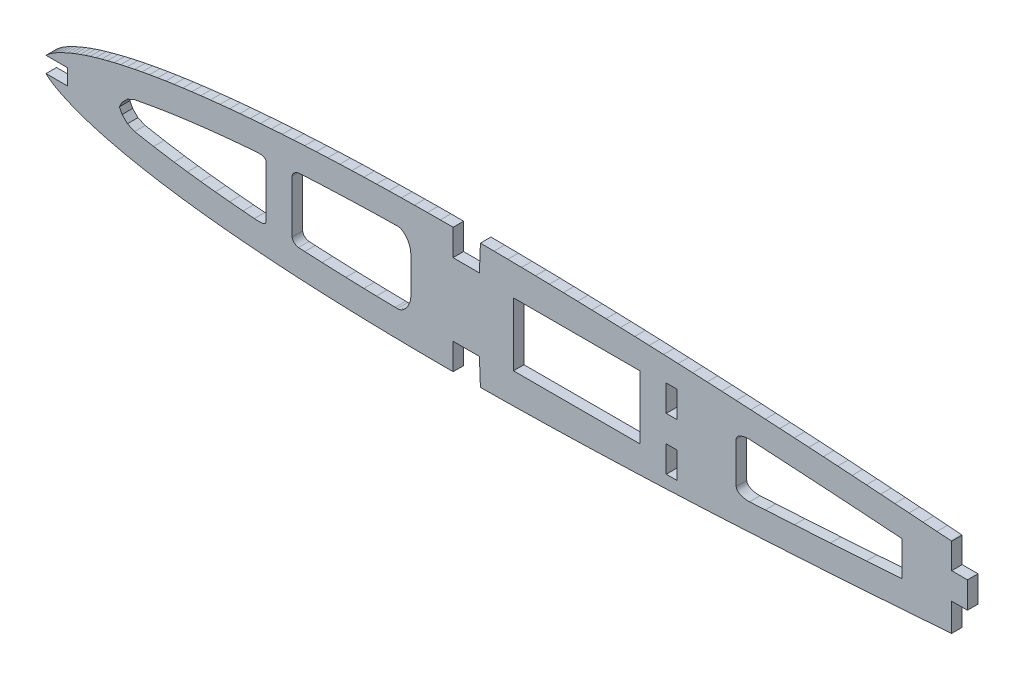
from build123d import *

# Parameters (mm, degrees)
MODEL_W         = 2
MODEL_H         = 5
MODEL_W_2       = 24
MODEL_H_2       = 12
EXTRUDE_1_DEPTH = 2


with BuildPart() as part:
    # Model → 凸台-拉伸1 (new body)
    with BuildSketch(Plane.XY):
        Polygon((334.143248695, -155.44282392), (338.256889144, -155.44282392), (338.256889144, -158.44282392), (334.143248695, -158.44282392), (334.295889144, -158.58582392), (334.709889144, -158.92782392), (335.143889144, -159.24382392), (335.593889144, -159.53882392), (336.183889144, -159.88482392), (336.786889144, -160.20382392), (337.400889144, -160.50382392), (338.162889144, -160.85382392), (338.933889144, -161.18382392), (339.711889144, -161.49582392), (340.639889144, -161.84082392), (341.575889144, -162.16382392), (342.517889144, -162.46682392), (343.609889144, -162.79382392), (344.707889144, -163.10182392), (345.809889144, -163.39282392), (347.059889144, -163.70282392), (348.313889144, -163.99482392), (349.571889144, -164.27082392), (350.974889144, -164.55982392), (352.379889144, -164.83082392), (353.789889144, -165.08582392), (355.338889144, -165.34982392), (356.890889144, -165.59882392), (358.444889144, -165.83182392), (360.135889144, -166.07082392), (361.827889144, -166.29382392), (363.522889144, -166.50182392), (365.348889144, -166.71182392), (367.175889144, -166.90782392), (369.003889144, -167.09082392), (370.955889144, -167.27182392), (372.908889144, -167.44082392), (374.862889144, -167.59682392), (376.933889144, -167.74982392), (379.004889144, -167.88882392), (381.077889144, -168.01682392), (383.259889144, -168.13782392), (385.441889144, -168.24782392), (387.624889144, -168.34582392), (389.908889144, -168.43782392), (392.192889144, -168.51882392), (394.477889144, -168.58882392), (396.853889144, -168.65082392), (399.230889144, -168.70282392), (401.607889144, -168.74482392), (404.068889144, -168.77682392), (406.528889144, -168.79982392), (408.990889144, -168.81282392), (411.420889144, -168.81782392), (411.403889144, -163.81782392), (416.403889144, -163.80082392), (416.595889144, -168.79982392), (419.193889144, -168.77782392), (421.791889144, -168.74682392), (424.389889144, -168.70782392), (427.042889144, -168.65882392), (429.693889144, -168.60282392), (432.345889144, -168.53882392), (435.041889144, -168.46682392), (437.737889144, -168.38782392), (440.432889144, -168.30082392), (443.160889144, -168.20682392), (445.887889144, -168.10582392), (448.615889144, -167.99782392), (451.366889144, -167.88382392), (454.116889144, -167.76282392), (456.866889144, -167.63682392), (459.627889144, -167.50282392), (462.386889144, -167.36382392), (465.146889144, -167.21682392), (467.907889144, -167.06382392), (470.666889144, -166.90682392), (473.426889144, -166.74482392), (476.177889144, -166.58182392), (478.927889144, -166.41582392), (481.677889144, -166.24382392), (484.405889144, -166.06782392), (487.132889144, -165.88582392), (489.860889144, -165.70082392), (492.556889144, -165.51382392), (495.251889144, -165.32382392), (497.947889144, -165.13082392), (500.599889144, -164.93682392), (503.251889144, -164.73882392), (505.903889144, -164.53682392), (506.039519295, -164.5263828), (506.039519295, -159.212811235), (509.039519295, -159.212811235), (509.039519295, -156.712811235), (509.039519295, -154.212811235), (506.039519295, -154.212811235), (506.039519295, -149.359265041), (505.903889144, -149.34882392), (503.251889144, -149.14682392), (500.599889144, -148.94982392), (497.947889144, -148.75482392), (495.251889144, -148.56182392), (492.556889144, -148.37182392), (489.860889144, -148.18582392), (487.132889144, -147.99982392), (484.405889144, -147.81782392), (481.677889144, -147.64182392), (478.927889144, -147.47082392), (476.177889144, -147.30382392), (473.426889144, -147.14082392), (470.666889144, -146.97982392), (467.907889144, -146.82182392), (465.146889144, -146.66882392), (462.386889144, -146.52182392), (459.627889144, -146.38282392), (456.866889144, -146.24882392), (454.116889144, -146.12282392), (451.366889144, -146.00282392), (448.615889144, -145.88782392), (445.887889144, -145.77982392), (443.160889144, -145.67882392), (440.432889144, -145.58482392), (437.737889144, -145.49782392), (435.041889144, -145.41882392), (432.345889144, -145.34682392), (429.693889144, -145.28282392), (427.042889144, -145.22682392), (424.389889144, -145.17882392), (421.791889144, -145.13882392), (419.193889144, -145.10782392), (416.595889144, -145.08582392), (416.403889144, -150.08482392), (411.403889144, -150.06882392), (411.420889144, -145.06882392), (408.990889144, -145.07282392), (406.528889144, -145.08582392), (404.068889144, -145.10882392), (401.607889144, -145.14182392), (399.230889144, -145.18282392), (396.853889144, -145.23482392), (394.477889144, -145.29682392), (392.192889144, -145.36682392), (389.908889144, -145.44782392), (387.624889144, -145.53982392), (385.441889144, -145.63782392), (383.259889144, -145.74782392), (381.077889144, -145.86982392), (379.004889144, -145.99682392), (376.933889144, -146.13682392), (374.862889144, -146.28882392), (372.908889144, -146.44482392), (370.955889144, -146.61382392), (369.003889144, -146.79482392), (367.175889144, -146.97782392), (365.348889144, -147.17382392), (363.522889144, -147.38382392), (361.827889144, -147.59182392), (360.135889144, -147.81482392), (358.444889144, -148.05382392), (356.890889144, -148.28682392), (355.338889144, -148.53582392), (353.789889144, -148.79982392), (352.379889144, -149.05582392), (350.974889144, -149.32682392), (349.571889144, -149.61482392), (348.313889144, -149.89082392), (347.059889144, -150.18282392), (345.809889144, -150.49382392), (344.707889144, -150.78382392), (343.609889144, -151.09182392), (342.517889144, -151.41982392), (341.575889144, -151.72182392), (340.639889144, -152.04482392), (339.711889144, -152.38982392), (338.933889144, -152.70182392), (338.162889144, -153.03282392), (337.400889144, -153.38182392), (336.786889144, -153.68182392), (336.183889144, -154.00182392), (335.593889144, -154.34782392), (335.143889144, -154.64182392), (334.709889144, -154.95782392), (334.295889144, -155.29982392), align=None)
        with BuildLine():
            Line((350.974889144, -154.32682392), (354.564389144, -153.66782392))
            Line((354.564389144, -153.66782392), (358.444889144, -153.05382392))
            Line((358.444889144, -153.05382392), (360.981889144, -152.70332392))
            Line((360.981889144, -152.70332392), (363.522889144, -152.38382392))
            Line((363.522889144, -152.38382392), (366.262389144, -152.07582392))
            Line((366.262389144, -152.07582392), (369.003889144, -151.79482392))
            Line((369.003889144, -151.79482392), (371.55294961, -151.562158166))
            Line((371.55294961, -151.562158166), (373.885889144, -151.36682392))
            add(Edge.make_bspline(
                [(373.885889144, -151.36682392), (374.57188636, -151.309386192), (375.869130292, -151.254426308), (375.869130292, -151.94282392)],
                knots=[0, 0, 0, 0, 2.065192836, 2.065192836, 2.065192836, 2.065192836], degree=3))
            Line((375.869130292, -151.94282392), (375.869130292, -161.94282392))
            add(Edge.make_bspline(
                [(373.690302964, -162.502447723), (374.437537705, -162.565012797), (375.869130292, -162.692673337), (375.869130292, -161.94282392)],
                knots=[0, 0, 0, 0, 2.249548249, 2.249548249, 2.249548249, 2.249548249], degree=3))
            Line((373.690302964, -162.502447723), (371.55294961, -162.323489675))
            Line((371.55294961, -162.323489675), (369.003889144, -162.09082392))
            Line((369.003889144, -162.09082392), (366.262389144, -161.80982392))
            Line((366.262389144, -161.80982392), (363.522889144, -161.50182392))
            Line((363.522889144, -161.50182392), (360.981889144, -161.18232392))
            Line((360.981889144, -161.18232392), (358.444889144, -160.83182392))
            Line((358.444889144, -160.83182392), (354.564389144, -160.21782392))
            Line((354.564389144, -160.21782392), (350.974889144, -159.55882392))
            Line((350.974889144, -159.55882392), (349.592803707, -158.968609857))
            Line((349.592803707, -158.968609857), (348.594737216, -157.944433447))
            Line((348.594737216, -157.944433447), (348.067982849, -156.94282392))
            Line((348.067982849, -156.94282392), (348.594737216, -155.941214394))
            Line((348.594737216, -155.941214394), (349.592803707, -154.917037983))
            Line((349.592803707, -154.917037983), (350.974889144, -154.32682392))
        make_face(mode=Mode.SUBTRACT)
        with BuildLine():
            Line((382.209953121, -150.808337555), (383.259889144, -150.74782392))
            Line((383.259889144, -150.74782392), (386.533389144, -150.58882392))
            Line((386.533389144, -150.58882392), (386.638514613, -150.584600285))
            Line((386.638514613, -150.584600285), (391.050889144, -150.40732392))
            Line((391.050889144, -150.40732392), (394.477889144, -150.29682392))
            Line((394.477889144, -150.29682392), (396.853889144, -150.23482392))
            Line((396.853889144, -150.23482392), (400.419389144, -150.16232392))
            Line((400.419389144, -150.16232392), (400.860465614, -150.15572893))
            add(Edge.make_bspline(
                [(400.860465614, -150.15572893), (402.218663341, -150.135421112), (403.377022467, -152.0025257), (403.377022467, -153.360875241)],
                knots=[0, 0, 0, 0, 4.075048621, 4.075048621, 4.075048621, 4.075048621], degree=3))
            Line((403.377022467, -153.360875241), (403.377022467, -160.52472392))
            add(Edge.make_bspline(
                [(400.835115058, -163.729539868), (402.198460562, -163.749924656), (403.377022467, -161.888221813), (403.377022467, -160.52472392)],
                knots=[0, 0, 0, 0, 4.090493678, 4.090493678, 4.090493678, 4.090493678], degree=3))
            Line((400.835115058, -163.729539868), (400.419389144, -163.72332392))
            Line((400.419389144, -163.72332392), (396.853889144, -163.65082392))
            Line((396.853889144, -163.65082392), (394.477889144, -163.58882392))
            Line((394.477889144, -163.58882392), (391.050889144, -163.47832392))
            Line((391.050889144, -163.47832392), (386.533389144, -163.29682392))
            Line((386.533389144, -163.29682392), (383.259889144, -163.13782392))
            Line((383.259889144, -163.13782392), (382.063363444, -163.06886151))
            add(Edge.make_bspline(
                [(382.063363444, -163.06886151), (381.517140706, -163.037379665), (380.869130292, -162.489953143), (380.869130292, -161.94282392)],
                knots=[0, 0, 0, 0, 1.641387667, 1.641387667, 1.641387667, 1.641387667], degree=3))
            Line((380.869130292, -161.94282392), (380.869130292, -151.94282392))
            add(Edge.make_bspline(
                [(382.209953121, -150.808337555), (381.625463636, -150.842024925), (380.869130292, -151.357364445), (380.869130292, -151.94282392)],
                knots=[0, 0, 0, 0, 1.756378426, 1.756378426, 1.756378426, 1.756378426], degree=3))
        make_face(mode=Mode.SUBTRACT)
        with BuildLine():
            Line((467.669272186, -151.810936443), (470.666889144, -151.97982392))
            Line((470.666889144, -151.97982392), (477.152883662, -152.364334944))
            Line((477.152883662, -152.364334944), (483.041889144, -152.72982392))
            Line((483.041889144, -152.72982392), (489.860889144, -153.18582392))
            Line((489.860889144, -153.18582392), (496.599889144, -153.65832392))
            Line((496.599889144, -153.65832392), (496.599889144, -160.22732392))
            Line((496.599889144, -160.22732392), (489.860889144, -160.69982392))
            Line((489.860889144, -160.69982392), (483.041889144, -161.15582392))
            Line((483.041889144, -161.15582392), (476.177889144, -161.58182392))
            Line((476.177889144, -161.58182392), (470.666889144, -161.90582392))
            Line((470.666889144, -161.90582392), (467.669272186, -162.074711398))
            add(Edge.make_bspline(
                [(465.146889144, -160.81492392), (465.146889144, -161.754751369), (466.730932824, -162.127577981), (467.669272186, -162.074711398)],
                knots=[0, 0, 0, 0, 2.819482345, 2.819482345, 2.819482345, 2.819482345], degree=3))
            Line((465.146889144, -160.81492392), (465.146889144, -153.070758953))
            add(Edge.make_bspline(
                [(465.146889144, -153.070758953), (465.146889144, -152.130926287), (466.730927615, -151.758069566), (467.669272186, -151.810936443)],
                knots=[0, 0, 0, 0, 2.819497999, 2.819497999, 2.819497999, 2.819497999], degree=3))
        make_face(mode=Mode.SUBTRACT)
        with Locations((452.864883669, -152.942823919)):
            Rectangle(MODEL_W, MODEL_H, mode=Mode.SUBTRACT)
        with Locations((452.864883669, -162.942823919)):
            Rectangle(MODEL_W, MODEL_H, mode=Mode.SUBTRACT)
        with Locations((434.864883669, -156.942823919)):
            Rectangle(MODEL_W_2, MODEL_H_2, mode=Mode.SUBTRACT)
    extrude(amount=EXTRUDE_1_DEPTH)


solid = part.part
